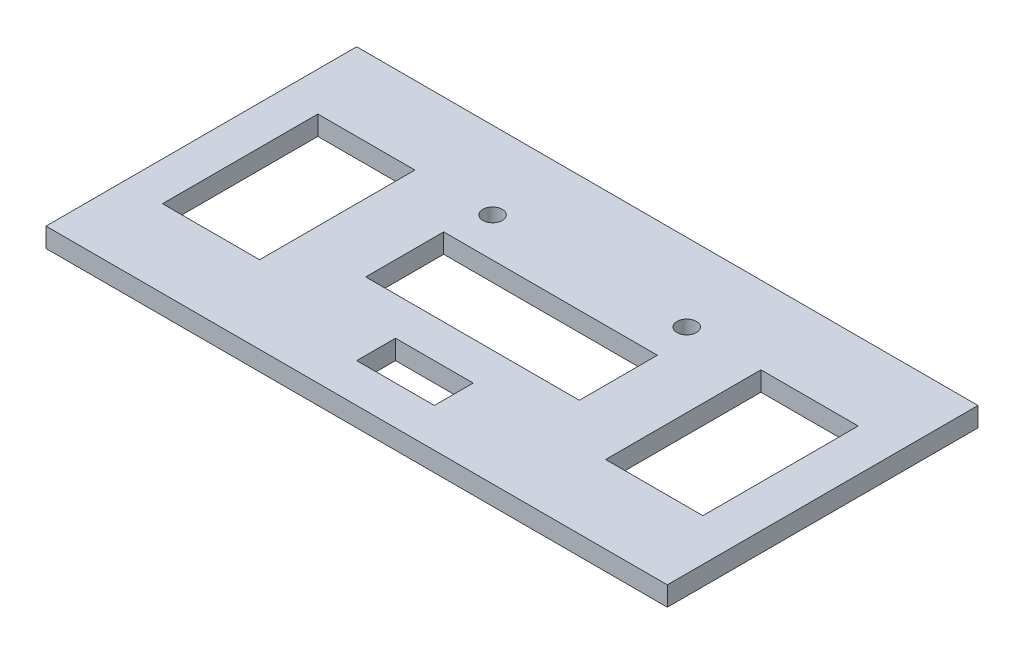
from build123d import *

# Parameters (mm, degrees)
SKETCH2_W           = 203.2
SKETCH2_H           = 101.6
SKETCH2_W_2         = 31.75
SKETCH2_H_2         = 50.8
SKETCH2_W_3         = 31.808931498
BOSS_EXTRUDE1_DEPTH = 6.35
SKETCH3_R           = 3.175
CUT_EXTRUDE1_DEPTH  = 34.544
SKETCH5_W           = 69.874867022
SKETCH5_H           = 25.509122939
CUT_EXTRUDE2_DEPTH  = 34.544
SKETCH6_W           = 25.4
SKETCH6_H           = 12.7
CUT_EXTRUDE3_DEPTH  = 34.544


with BuildPart() as part:
    # Sketch2 → Boss-Extrude1 (new body)
    with BuildSketch(Plane(origin=(0, 0, 0), x_dir=(1, 0, 0), z_dir=(0, 1, 0))):
        with Locations((101.6, 50.8)):
            Rectangle(SKETCH2_W, SKETCH2_H)
        with Locations((28.575, 50.8)):
            Rectangle(SKETCH2_W_2, SKETCH2_H_2, mode=Mode.SUBTRACT)
        with Locations((173.511909894, 50.8)):
            Rectangle(SKETCH2_W_3, SKETCH2_H_2, mode=Mode.SUBTRACT)
    extrude(amount=BOSS_EXTRUDE1_DEPTH)

    # Sketch3 → Cut-Extrude1 (cut)
    with BuildSketch(Plane(origin=(0, 6.35, 0), x_dir=(1, 0, 0), z_dir=(0, 1, 0))):
        with Locations(Location((69.85, 76.2, 0), (0, 0, 270))):
            Circle(SKETCH3_R)
        with Locations(Location((133.35, 76.2, 0), (0, 0, 270))):
            Circle(SKETCH3_R)
    extrude(amount=-CUT_EXTRUDE1_DEPTH, mode=Mode.SUBTRACT)

    # Sketch5 → Cut-Extrude2 (cut)
    with BuildSketch(Plane(origin=(0, 6.35, 0), x_dir=(1, 0, 0), z_dir=(0, 1, 0))):
        with Locations((101.604794403, 50.641324615)):
            Rectangle(SKETCH5_W, SKETCH5_H)
    extrude(amount=-CUT_EXTRUDE2_DEPTH, mode=Mode.SUBTRACT)

    # Sketch6 → Cut-Extrude3 (cut)
    with BuildSketch(Plane(origin=(0, 6.35, 0), x_dir=(1, 0, 0), z_dir=(0, 1, 0))):
        with Locations((101.6, 19.05)):
            Rectangle(SKETCH6_W, SKETCH6_H)
    extrude(amount=-CUT_EXTRUDE3_DEPTH, mode=Mode.SUBTRACT)


solid = part.part
